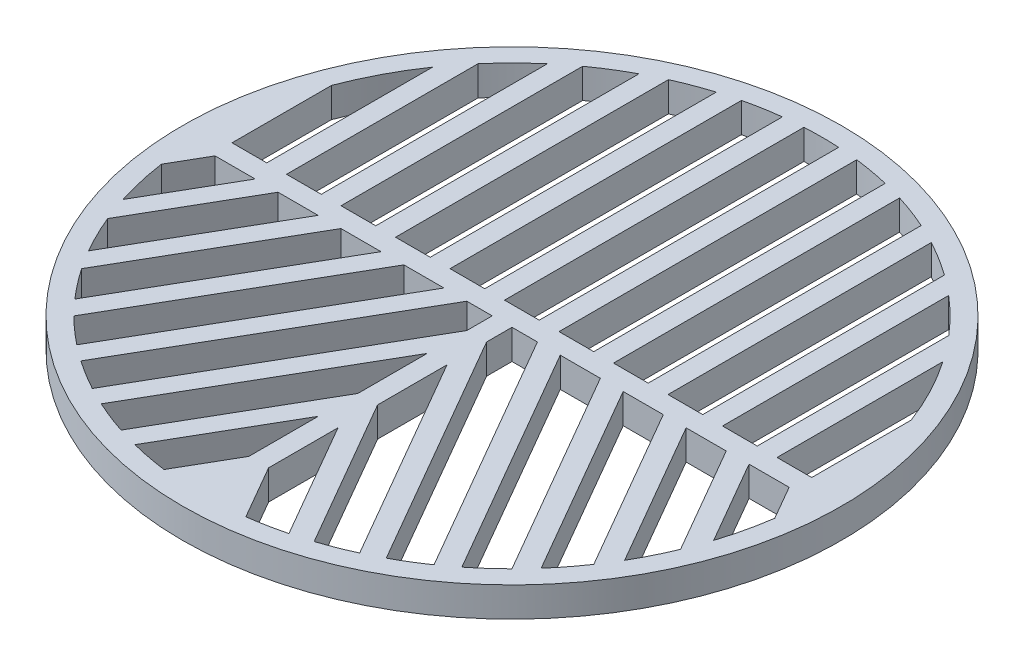
from build123d import *

# Parameters (mm, degrees)
SKETCH1_R           = 33.325
BOSS_EXTRUDE1_DEPTH = 3


with BuildPart() as part:
    # Sketch1 → Boss-Extrude1 (new body)
    with BuildSketch(Plane(origin=(0, 0, 0), x_dir=(1, 0, 0), z_dir=(0, 1, 0))):
        with Locations(Location((0, 0, 0), (0, 0, 270))):
            Circle(SKETCH1_R)
        with BuildLine():
            Line((1.755453897, 1), (1.755453897, 31.275773477))
            ThreePointArc((1.755453897, 31.275773477), (0, 31.325), (-1.755453897, 31.275773477))
            Line((-1.755453897, 31.275773477), (-1.755453897, 1))
            Line((-1.755453897, 1), (1.755453897, 1))
        make_face(mode=Mode.SUBTRACT)
        with BuildLine():
            Line((29.30999287, 1), (29.30999287, 11.053503651))
            ThreePointArc((29.30999287, 11.053503651), (27.758242919, 14.516734311), (25.799085075, 17.766902776))
            Line((25.799085075, 17.766902776), (25.799085075, 1))
            Line((25.799085075, 1), (29.30999287, 1))
        make_face(mode=Mode.SUBTRACT)
        with BuildLine():
            Line((3.755453897, 1), (7.266361692, 1))
            Line((7.266361692, 1), (7.266361692, 30.470569617))
            ThreePointArc((7.266361692, 30.470569617), (5.519860332, 30.834830418), (3.755453897, 31.099070581))
            Line((3.755453897, 31.099070581), (3.755453897, 1))
        make_face(mode=Mode.SUBTRACT)
        with BuildLine():
            Line((9.266361692, 1), (12.777269486, 1))
            Line((12.777269486, 1), (12.777269486, 28.600647011))
            ThreePointArc((12.777269486, 28.600647011), (11.041631222, 29.314467502), (9.266361692, 29.923070798))
            Line((9.266361692, 29.923070798), (9.266361692, 1))
        make_face(mode=Mode.SUBTRACT)
        with BuildLine():
            Line((14.777269486, 1), (18.288177281, 1))
            Line((18.288177281, 1), (18.288177281, 25.432227522))
            ThreePointArc((18.288177281, 25.432227522), (16.568886372, 26.584349332), (14.777269486, 27.620425984))
            Line((14.777269486, 27.620425984), (14.777269486, 1))
        make_face(mode=Mode.SUBTRACT)
        with BuildLine():
            Line((20.288177281, 1), (23.799085075, 1))
            Line((23.799085075, 1), (23.799085075, 20.36809207))
            ThreePointArc((23.799085075, 20.36809207), (22.112953153, 22.187224429), (20.288177281, 23.867247173))
            Line((20.288177281, 23.867247173), (20.288177281, 1))
        make_face(mode=Mode.SUBTRACT)
        with BuildLine():
            Line((1, -3.570162886), (1, -1))
            Line((1, -1), (3.570162886, -1))
            Line((3.570162886, -1), (17.853404495, -25.739300164))
            ThreePointArc((17.853404495, -25.739300164), (16.382380994, -26.699685728), (14.859831538, -27.576095294))
            Line((14.859831538, -27.576095294), (1, -3.570162886))
        make_face(mode=Mode.SUBTRACT)
        with BuildLine():
            Line((5.879563963, -1), (19.469969491, -24.53927287))
            ThreePointArc((19.469969491, -24.53927287), (20.842468862, -23.384762491), (22.146644648, -22.153594648))
            Line((22.146644648, -22.153594648), (9.933611084, -1))
            Line((9.933611084, -1), (5.879563963, -1))
        make_face(mode=Mode.SUBTRACT)
        with BuildLine():
            Line((12.24301216, -1), (23.574814489, -20.627257375))
            ThreePointArc((23.574814489, -20.627257375), (24.780818594, -19.161593223), (25.895841507, -17.625578506))
            Line((25.895841507, -17.625578506), (16.297059281, -1))
            Line((16.297059281, -1), (12.24301216, -1))
        make_face(mode=Mode.SUBTRACT)
        with BuildLine():
            Line((18.606460358, -1), (27.100022956, -15.711281958))
            ThreePointArc((27.100022956, -15.711281958), (28.097453336, -13.848781211), (28.967067125, -11.923281729))
            Line((28.967067125, -11.923281729), (22.660507478, -1))
            Line((22.660507478, -1), (18.606460358, -1))
        make_face(mode=Mode.SUBTRACT)
        with BuildLine():
            Line((24.969908555, -1), (29.85953815, -9.469086888))
            ThreePointArc((29.85953815, -9.469086888), (30.538044757, -6.977352466), (31.0089993, -4.438196413))
            Line((31.0089993, -4.438196413), (29.023955676, -1))
            Line((29.023955676, -1), (24.969908555, -1))
        make_face(mode=Mode.SUBTRACT)
        with BuildLine():
            Line((1, -7.570162886), (13.066371144, -28.46973077))
            ThreePointArc((13.066371144, -28.46973077), (11.431797975, -29.164526742), (9.760473509, -29.765563692))
            Line((9.760473509, -29.765563692), (1, -14.591978475))
            Line((1, -14.591978475), (1, -7.570162886))
        make_face(mode=Mode.SUBTRACT)
        with BuildLine():
            Line((1, -18.591978475), (7.784125884, -30.342429191))
            ThreePointArc((7.784125884, -30.342429191), (5.971968683, -30.750466908), (4.138812131, -31.050376151))
            Line((4.138812131, -31.050376151), (1, -25.613794064))
            Line((1, -25.613794064), (1, -18.591978475))
        make_face(mode=Mode.SUBTRACT)
        with BuildLine():
            Line((-29.30999287, 1), (-25.799085075, 1))
            Line((-25.799085075, 1), (-25.799085075, 17.766902776))
            ThreePointArc((-25.799085075, 17.766902776), (-27.758242919, 14.516734311), (-29.30999287, 11.053503651))
            Line((-29.30999287, 11.053503651), (-29.30999287, 1))
        make_face(mode=Mode.SUBTRACT)
        with BuildLine():
            Line((-20.288177281, 1), (-23.799085075, 1))
            Line((-23.799085075, 1), (-23.799085075, 20.36809207))
            ThreePointArc((-23.799085075, 20.36809207), (-22.112953153, 22.187224429), (-20.288177281, 23.867247173))
            Line((-20.288177281, 23.867247173), (-20.288177281, 1))
        make_face(mode=Mode.SUBTRACT)
        with BuildLine():
            Line((-14.777269486, 1), (-18.288177281, 1))
            Line((-18.288177281, 1), (-18.288177281, 25.432227522))
            ThreePointArc((-18.288177281, 25.432227522), (-16.568886372, 26.584349332), (-14.777269486, 27.620425984))
            Line((-14.777269486, 27.620425984), (-14.777269486, 1))
        make_face(mode=Mode.SUBTRACT)
        with BuildLine():
            Line((-9.266361692, 1), (-12.777269486, 1))
            Line((-12.777269486, 1), (-12.777269486, 28.600647011))
            ThreePointArc((-12.777269486, 28.600647011), (-11.041631222, 29.314467502), (-9.266361692, 29.923070798))
            Line((-9.266361692, 29.923070798), (-9.266361692, 1))
        make_face(mode=Mode.SUBTRACT)
        with BuildLine():
            Line((-3.755453897, 1), (-7.266361692, 1))
            Line((-7.266361692, 1), (-7.266361692, 30.470569617))
            ThreePointArc((-7.266361692, 30.470569617), (-5.519860332, 30.834830418), (-3.755453897, 31.099070581))
            Line((-3.755453897, 31.099070581), (-3.755453897, 1))
        make_face(mode=Mode.SUBTRACT)
        with BuildLine():
            Line((-24.969908555, -1), (-29.023955676, -1))
            Line((-29.023955676, -1), (-31.0089993, -4.438196413))
            ThreePointArc((-31.0089993, -4.438196413), (-30.538044757, -6.977352466), (-29.85953815, -9.469086888))
            Line((-29.85953815, -9.469086888), (-24.969908555, -1))
        make_face(mode=Mode.SUBTRACT)
        with BuildLine():
            Line((-18.606460358, -1), (-22.660507478, -1))
            Line((-22.660507478, -1), (-28.967067125, -11.923281729))
            ThreePointArc((-28.967067125, -11.923281729), (-28.097453336, -13.848781211), (-27.100022956, -15.711281958))
            Line((-27.100022956, -15.711281958), (-18.606460358, -1))
        make_face(mode=Mode.SUBTRACT)
        with BuildLine():
            Line((-12.24301216, -1), (-16.297059281, -1))
            Line((-16.297059281, -1), (-25.895841507, -17.625578506))
            ThreePointArc((-25.895841507, -17.625578506), (-24.780818594, -19.161593223), (-23.574814489, -20.627257375))
            Line((-23.574814489, -20.627257375), (-12.24301216, -1))
        make_face(mode=Mode.SUBTRACT)
        with BuildLine():
            Line((-5.879563963, -1), (-9.933611084, -1))
            Line((-9.933611084, -1), (-22.146644648, -22.153594648))
            ThreePointArc((-22.146644648, -22.153594648), (-20.842468862, -23.384762491), (-19.469969491, -24.53927287))
            Line((-19.469969491, -24.53927287), (-5.879563963, -1))
        make_face(mode=Mode.SUBTRACT)
        with BuildLine():
            Line((-1, -1), (-3.570162886, -1))
            Line((-3.570162886, -1), (-17.853404495, -25.739300164))
            ThreePointArc((-17.853404495, -25.739300164), (-16.382380994, -26.699685728), (-14.859831538, -27.576095294))
            Line((-14.859831538, -27.576095294), (-1, -3.570162886))
            Line((-1, -3.570162886), (-1, -1))
        make_face(mode=Mode.SUBTRACT)
        with BuildLine():
            Line((-1, -7.570162886), (-1, -14.591978475))
            Line((-1, -14.591978475), (-9.760473509, -29.765563692))
            ThreePointArc((-9.760473509, -29.765563692), (-11.431797975, -29.164526742), (-13.066371144, -28.46973077))
            Line((-13.066371144, -28.46973077), (-1, -7.570162886))
        make_face(mode=Mode.SUBTRACT)
        with BuildLine():
            Line((-1, -18.591978475), (-1, -25.613794064))
            Line((-1, -25.613794064), (-4.138812131, -31.050376151))
            ThreePointArc((-4.138812131, -31.050376151), (-5.971968683, -30.750466908), (-7.784125884, -30.342429191))
            Line((-7.784125884, -30.342429191), (-1, -18.591978475))
        make_face(mode=Mode.SUBTRACT)
    extrude(amount=BOSS_EXTRUDE1_DEPTH)


solid = part.part
